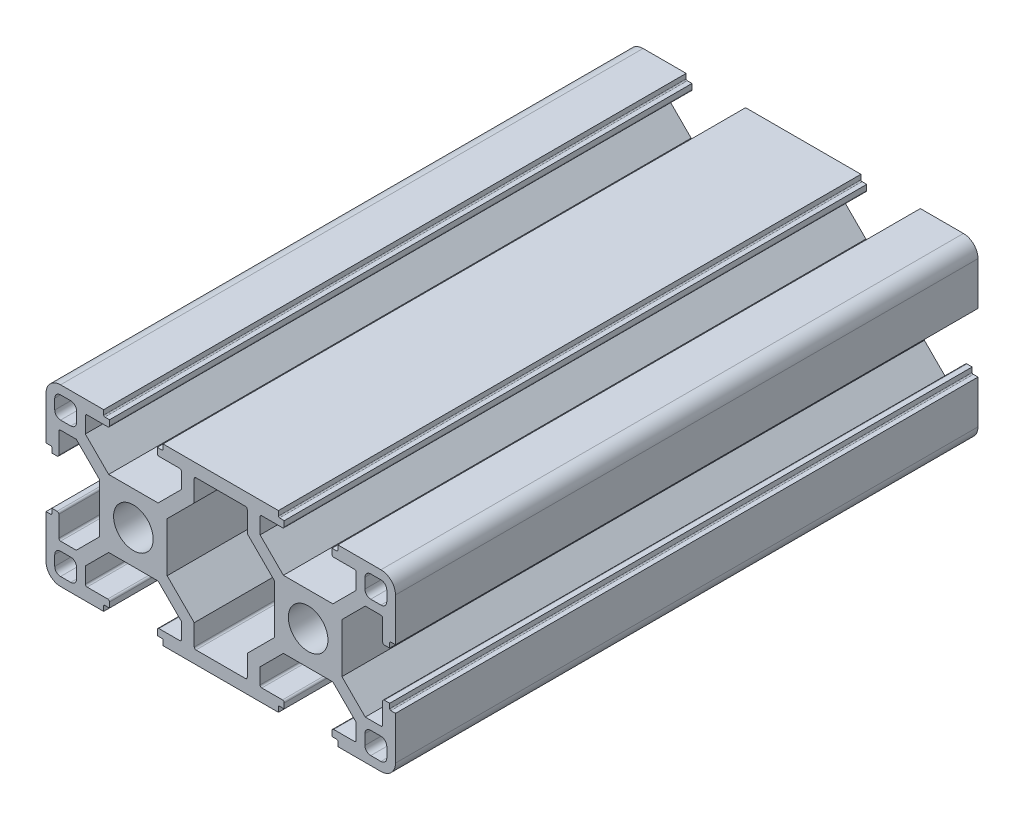
from build123d import *

# Parameters (mm, degrees)
SKETCH_1_R      = 3.4
EXTRUDE_1_DEPTH = 100


with BuildPart() as part:
    # 草图1 → 凸台-拉伸1 (new body)
    with BuildSketch(Plane.XY):
        with BuildLine():
            Line((-13.596789658, 10.693878955), (-20.996789658, 10.693878955))
            Line((-20.996789658, 10.693878955), (-20.996789658, 9.893878955))
            ThreePointArc((-20.996789658, 9.893878955), (-21.055368301, 9.752457598), (-21.196789658, 9.693878955))
            Line((-21.196789658, 9.693878955), (-21.996789658, 9.693878955))
            Line((-21.996789658, 9.693878955), (-21.996789658, 8.793878955))
            ThreePointArc((-21.996789658, 8.793878955), (-21.908921692, 8.58174692), (-21.696789658, 8.493878955))
            Line((-21.696789658, 8.493878955), (-18.146789658, 8.493878955))
            ThreePointArc((-18.146789658, 8.493878955), (-17.934657623, 8.406010989), (-17.846789658, 8.193878955))
            Line((-17.846789658, 8.193878955), (-17.846789658, 5.499513873))
            Line((-17.846789658, 5.499513873), (-21.852424576, 1.493878955))
            Line((-21.852424576, 1.493878955), (-30.341154739, 1.493878955))
            Line((-30.341154739, 1.493878955), (-34.346789658, 5.499513873))
            Line((-34.346789658, 5.499513873), (-34.346789658, 8.193878955))
            ThreePointArc((-34.346789658, 8.193878955), (-34.258921692, 8.406010989), (-34.046789658, 8.493878955))
            Line((-34.046789658, 8.493878955), (-30.496789658, 8.493878955))
            ThreePointArc((-30.496789658, 8.493878955), (-30.284657623, 8.58174692), (-30.196789658, 8.793878955))
            Line((-30.196789658, 8.793878955), (-30.196789658, 9.693878955))
            Line((-30.196789658, 9.693878955), (-30.996789658, 9.693878955))
            ThreePointArc((-30.996789658, 9.693878955), (-31.138211014, 9.752457598), (-31.196789658, 9.893878955))
            Line((-31.196789658, 9.893878955), (-31.196789658, 10.693878955))
            Line((-31.196789658, 10.693878955), (-38.596789658, 10.693878955))
            ThreePointArc((-38.596789658, 10.693878955), (-40.364556611, 9.961645908), (-41.096789658, 8.193878955))
            Line((-41.096789658, 8.193878955), (-41.096789658, 0.793878955))
            Line((-41.096789658, 0.793878955), (-40.296789658, 0.793878955))
            ThreePointArc((-40.296789658, 0.793878955), (-40.155368301, 0.735300311), (-40.096789658, 0.593878955))
            Line((-40.096789658, 0.593878955), (-40.096789658, -0.206121045))
            Line((-40.096789658, -0.206121045), (-39.196789658, -0.206121045))
            ThreePointArc((-39.196789658, -0.206121045), (-38.984657623, -0.11825308), (-38.896789658, 0.093878955))
            Line((-38.896789658, 0.093878955), (-38.896789658, 3.643878955))
            ThreePointArc((-38.896789658, 3.643878955), (-38.808921692, 3.856010989), (-38.596789658, 3.943878955))
            Line((-38.596789658, 3.943878955), (-35.902424576, 3.943878955))
            Line((-35.902424576, 3.943878955), (-31.896789658, -0.061755964))
            Line((-31.896789658, -0.061755964), (-31.896789658, -8.550486127))
            Line((-31.896789658, -8.550486127), (-35.902424576, -12.556121045))
            Line((-35.902424576, -12.556121045), (-38.596789658, -12.556121045))
            ThreePointArc((-38.596789658, -12.556121045), (-38.808921692, -12.46825308), (-38.896789658, -12.256121045))
            Line((-38.896789658, -12.256121045), (-38.896789658, -8.706121045))
            ThreePointArc((-38.896789658, -8.706121045), (-38.984657623, -8.493989011), (-39.196789658, -8.406121045))
            Line((-39.196789658, -8.406121045), (-40.096789658, -8.406121045))
            Line((-40.096789658, -8.406121045), (-40.096789658, -9.206121045))
            ThreePointArc((-40.096789658, -9.206121045), (-40.155368301, -9.347542402), (-40.296789658, -9.406121045))
            Line((-40.296789658, -9.406121045), (-41.096789658, -9.406121045))
            Line((-41.096789658, -9.406121045), (-41.096789658, -16.806121045))
            ThreePointArc((-41.096789658, -16.806121045), (-40.364556611, -18.573887998), (-38.596789658, -19.306121045))
            Line((-38.596789658, -19.306121045), (-31.196789658, -19.306121045))
            Line((-31.196789658, -19.306121045), (-31.196789658, -18.506121045))
            ThreePointArc((-31.196789658, -18.506121045), (-31.138211014, -18.364699689), (-30.996789658, -18.306121045))
            Line((-30.996789658, -18.306121045), (-30.196789658, -18.306121045))
            Line((-30.196789658, -18.306121045), (-30.196789658, -17.406121045))
            ThreePointArc((-30.196789658, -17.406121045), (-30.284657623, -17.193989011), (-30.496789658, -17.106121045))
            Line((-30.496789658, -17.106121045), (-34.046789658, -17.106121045))
            ThreePointArc((-34.046789658, -17.106121045), (-34.258921692, -17.01825308), (-34.346789658, -16.806121045))
            Line((-34.346789658, -16.806121045), (-34.346789658, -14.111755964))
            Line((-34.346789658, -14.111755964), (-30.341154739, -10.106121045))
            Line((-30.341154739, -10.106121045), (-21.852424576, -10.106121045))
            Line((-21.852424576, -10.106121045), (-17.846789658, -14.111755964))
            Line((-17.846789658, -14.111755964), (-17.846789658, -16.806121045))
            ThreePointArc((-17.846789658, -16.806121045), (-17.934657623, -17.01825308), (-18.146789658, -17.106121045))
            Line((-18.146789658, -17.106121045), (-21.696789658, -17.106121045))
            ThreePointArc((-21.696789658, -17.106121045), (-21.908921692, -17.193989011), (-21.996789658, -17.406121045))
            Line((-21.996789658, -17.406121045), (-21.996789658, -18.306121045))
            Line((-21.996789658, -18.306121045), (-21.196789658, -18.306121045))
            ThreePointArc((-21.196789658, -18.306121045), (-21.055368301, -18.364699689), (-20.996789658, -18.506121045))
            Line((-20.996789658, -18.506121045), (-20.996789658, -19.306121045))
            Line((-20.996789658, -19.306121045), (-13.596789658, -19.306121045))
            Line((-13.596789658, -19.306121045), (-8.596789658, -19.306121045))
            Line((-8.596789658, -19.306121045), (-1.196789658, -19.306121045))
            Line((-1.196789658, -19.306121045), (-1.196789658, -18.506121045))
            ThreePointArc((-1.196789658, -18.506121045), (-1.138211014, -18.364699689), (-0.996789658, -18.306121045))
            Line((-0.996789658, -18.306121045), (-0.196789658, -18.306121045))
            Line((-0.196789658, -18.306121045), (-0.196789658, -17.406121045))
            ThreePointArc((-0.196789658, -17.406121045), (-0.284657623, -17.193989011), (-0.496789658, -17.106121045))
            Line((-0.496789658, -17.106121045), (-4.046789658, -17.106121045))
            ThreePointArc((-4.046789658, -17.106121045), (-4.258921692, -17.01825308), (-4.346789658, -16.806121045))
            Line((-4.346789658, -16.806121045), (-4.346789658, -14.111755964))
            Line((-4.346789658, -14.111755964), (-0.341154739, -10.106121045))
            Line((-0.341154739, -10.106121045), (8.147575424, -10.106121045))
            Line((8.147575424, -10.106121045), (12.153210342, -14.111755964))
            Line((12.153210342, -14.111755964), (12.153210342, -16.806121045))
            ThreePointArc((12.153210342, -16.806121045), (12.065342377, -17.01825308), (11.853210342, -17.106121045))
            Line((11.853210342, -17.106121045), (8.303210342, -17.106121045))
            ThreePointArc((8.303210342, -17.106121045), (8.091078308, -17.193989011), (8.003210342, -17.406121045))
            Line((8.003210342, -17.406121045), (8.003210342, -18.306121045))
            Line((8.003210342, -18.306121045), (8.803210342, -18.306121045))
            ThreePointArc((8.803210342, -18.306121045), (8.944631699, -18.364699689), (9.003210342, -18.506121045))
            Line((9.003210342, -18.506121045), (9.003210342, -19.306121045))
            Line((9.003210342, -19.306121045), (16.403210342, -19.306121045))
            ThreePointArc((16.403210342, -19.306121045), (18.170977295, -18.573887998), (18.903210342, -16.806121045))
            Line((18.903210342, -16.806121045), (18.903210342, -9.406121045))
            Line((18.903210342, -9.406121045), (18.103210342, -9.406121045))
            ThreePointArc((18.103210342, -9.406121045), (17.961788986, -9.347542402), (17.903210342, -9.206121045))
            Line((17.903210342, -9.206121045), (17.903210342, -8.406121045))
            Line((17.903210342, -8.406121045), (17.003210342, -8.406121045))
            ThreePointArc((17.003210342, -8.406121045), (16.791078308, -8.493989011), (16.703210342, -8.706121045))
            Line((16.703210342, -8.706121045), (16.703210342, -12.256121045))
            ThreePointArc((16.703210342, -12.256121045), (16.615342377, -12.46825308), (16.403210342, -12.556121045))
            Line((16.403210342, -12.556121045), (13.708845261, -12.556121045))
            Line((13.708845261, -12.556121045), (9.703210342, -8.550486127))
            Line((9.703210342, -8.550486127), (9.703210342, -0.061755964))
            Line((9.703210342, -0.061755964), (13.708845261, 3.943878955))
            Line((13.708845261, 3.943878955), (16.403210342, 3.943878955))
            ThreePointArc((16.403210342, 3.943878955), (16.615342377, 3.856010989), (16.703210342, 3.643878955))
            Line((16.703210342, 3.643878955), (16.703210342, 0.093878955))
            ThreePointArc((16.703210342, 0.093878955), (16.791078308, -0.11825308), (17.003210342, -0.206121045))
            Line((17.003210342, -0.206121045), (17.903210342, -0.206121045))
            Line((17.903210342, -0.206121045), (17.903210342, 0.593878955))
            ThreePointArc((17.903210342, 0.593878955), (17.961788986, 0.735300311), (18.103210342, 0.793878955))
            Line((18.103210342, 0.793878955), (18.903210342, 0.793878955))
            Line((18.903210342, 0.793878955), (18.903210342, 8.193878955))
            ThreePointArc((18.903210342, 8.193878955), (18.170977295, 9.961645908), (16.403210342, 10.693878955))
            Line((16.403210342, 10.693878955), (9.003210342, 10.693878955))
            Line((9.003210342, 10.693878955), (9.003210342, 9.893878955))
            ThreePointArc((9.003210342, 9.893878955), (8.944631699, 9.752457598), (8.803210342, 9.693878955))
            Line((8.803210342, 9.693878955), (8.003210342, 9.693878955))
            Line((8.003210342, 9.693878955), (8.003210342, 8.793878955))
            ThreePointArc((8.003210342, 8.793878955), (8.091078308, 8.58174692), (8.303210342, 8.493878955))
            Line((8.303210342, 8.493878955), (11.853210342, 8.493878955))
            ThreePointArc((11.853210342, 8.493878955), (12.065342377, 8.406010989), (12.153210342, 8.193878955))
            Line((12.153210342, 8.193878955), (12.153210342, 5.499513873))
            Line((12.153210342, 5.499513873), (8.147575424, 1.493878955))
            Line((8.147575424, 1.493878955), (-0.341154739, 1.493878955))
            Line((-0.341154739, 1.493878955), (-4.346789658, 5.499513873))
            Line((-4.346789658, 5.499513873), (-4.346789658, 8.193878955))
            ThreePointArc((-4.346789658, 8.193878955), (-4.258921692, 8.406010989), (-4.046789658, 8.493878955))
            Line((-4.046789658, 8.493878955), (-0.496789658, 8.493878955))
            ThreePointArc((-0.496789658, 8.493878955), (-0.284657623, 8.58174692), (-0.196789658, 8.793878955))
            Line((-0.196789658, 8.793878955), (-0.196789658, 9.693878955))
            Line((-0.196789658, 9.693878955), (-0.996789658, 9.693878955))
            ThreePointArc((-0.996789658, 9.693878955), (-1.138211014, 9.752457598), (-1.196789658, 9.893878955))
            Line((-1.196789658, 9.893878955), (-1.196789658, 10.693878955))
            Line((-1.196789658, 10.693878955), (-8.596789658, 10.693878955))
            Line((-8.596789658, 10.693878955), (-13.596789658, 10.693878955))
        make_face()
        with Locations((3.903210342, -4.306121045)):
            Circle(SKETCH_1_R, mode=Mode.SUBTRACT)
        with Locations((-26.096789658, -4.306121045)):
            Circle(SKETCH_1_R, mode=Mode.SUBTRACT)
        with BuildLine():
            Line((-35.846789658, -15.056121045), (-35.846789658, -16.806121045))
            ThreePointArc((-35.846789658, -16.806121045), (-36.139682876, -17.513227827), (-36.846789658, -17.806121045))
            Line((-36.846789658, -17.806121045), (-38.596789658, -17.806121045))
            ThreePointArc((-38.596789658, -17.806121045), (-39.303896439, -17.513227827), (-39.596789658, -16.806121045))
            Line((-39.596789658, -16.806121045), (-39.596789658, -15.056121045))
            ThreePointArc((-39.596789658, -15.056121045), (-39.303896439, -14.349014264), (-38.596789658, -14.056121045))
            Line((-38.596789658, -14.056121045), (-36.846789658, -14.056121045))
            ThreePointArc((-36.846789658, -14.056121045), (-36.139682876, -14.349014264), (-35.846789658, -15.056121045))
        make_face(mode=Mode.SUBTRACT)
        with BuildLine():
            Line((-36.846789658, 5.443878955), (-38.596789658, 5.443878955))
            ThreePointArc((-38.596789658, 5.443878955), (-39.303896439, 5.736772173), (-39.596789658, 6.443878955))
            Line((-39.596789658, 6.443878955), (-39.596789658, 8.193878955))
            ThreePointArc((-39.596789658, 8.193878955), (-39.303896439, 8.900985736), (-38.596789658, 9.193878955))
            Line((-38.596789658, 9.193878955), (-36.846789658, 9.193878955))
            ThreePointArc((-36.846789658, 9.193878955), (-36.139682876, 8.900985736), (-35.846789658, 8.193878955))
            Line((-35.846789658, 8.193878955), (-35.846789658, 6.443878955))
            ThreePointArc((-35.846789658, 6.443878955), (-36.139682876, 5.736772173), (-36.846789658, 5.443878955))
        make_face(mode=Mode.SUBTRACT)
        with BuildLine():
            Line((-15.646789658, -13.200486127), (-20.296789658, -8.550486127))
            Line((-20.296789658, -8.550486127), (-20.296789658, -0.061755964))
            Line((-20.296789658, -0.061755964), (-15.646789658, 4.588244036))
            Line((-15.646789658, 4.588244036), (-15.646789658, 8.193878955))
            ThreePointArc((-15.646789658, 8.193878955), (-15.558921692, 8.406010989), (-15.346789658, 8.493878955))
            Line((-15.346789658, 8.493878955), (-6.846789658, 8.493878955))
            ThreePointArc((-6.846789658, 8.493878955), (-6.634657623, 8.406010989), (-6.546789658, 8.193878955))
            Line((-6.546789658, 8.193878955), (-6.546789658, 4.588244036))
            Line((-6.546789658, 4.588244036), (-1.896789658, -0.061755964))
            Line((-1.896789658, -0.061755964), (-1.896789658, -8.550486127))
            Line((-1.896789658, -8.550486127), (-6.546789658, -13.200486127))
            Line((-6.546789658, -13.200486127), (-6.546789658, -16.806121045))
            ThreePointArc((-6.546789658, -16.806121045), (-6.634657623, -17.01825308), (-6.846789658, -17.106121045))
            Line((-6.846789658, -17.106121045), (-15.346789658, -17.106121045))
            ThreePointArc((-15.346789658, -17.106121045), (-15.558921692, -17.01825308), (-15.646789658, -16.806121045))
            Line((-15.646789658, -16.806121045), (-15.646789658, -13.200486127))
        make_face(mode=Mode.SUBTRACT)
        with BuildLine():
            Line((14.653210342, -14.056121045), (16.403210342, -14.056121045))
            ThreePointArc((16.403210342, -14.056121045), (17.110317124, -14.349014264), (17.403210342, -15.056121045))
            Line((17.403210342, -15.056121045), (17.403210342, -16.806121045))
            ThreePointArc((17.403210342, -16.806121045), (17.110317124, -17.513227827), (16.403210342, -17.806121045))
            Line((16.403210342, -17.806121045), (14.653210342, -17.806121045))
            ThreePointArc((14.653210342, -17.806121045), (13.946103561, -17.513227827), (13.653210342, -16.806121045))
            Line((13.653210342, -16.806121045), (13.653210342, -15.056121045))
            ThreePointArc((13.653210342, -15.056121045), (13.946103561, -14.349014264), (14.653210342, -14.056121045))
        make_face(mode=Mode.SUBTRACT)
        with BuildLine():
            Line((13.653210342, 6.443878955), (13.653210342, 8.193878955))
            ThreePointArc((13.653210342, 8.193878955), (13.946103561, 8.900985736), (14.653210342, 9.193878955))
            Line((14.653210342, 9.193878955), (16.403210342, 9.193878955))
            ThreePointArc((16.403210342, 9.193878955), (17.110317124, 8.900985736), (17.403210342, 8.193878955))
            Line((17.403210342, 8.193878955), (17.403210342, 6.443878955))
            ThreePointArc((17.403210342, 6.443878955), (17.110317124, 5.736772173), (16.403210342, 5.443878955))
            Line((16.403210342, 5.443878955), (14.653210342, 5.443878955))
            ThreePointArc((14.653210342, 5.443878955), (13.946103561, 5.736772173), (13.653210342, 6.443878955))
        make_face(mode=Mode.SUBTRACT)
    extrude(amount=EXTRUDE_1_DEPTH)


solid = part.part
